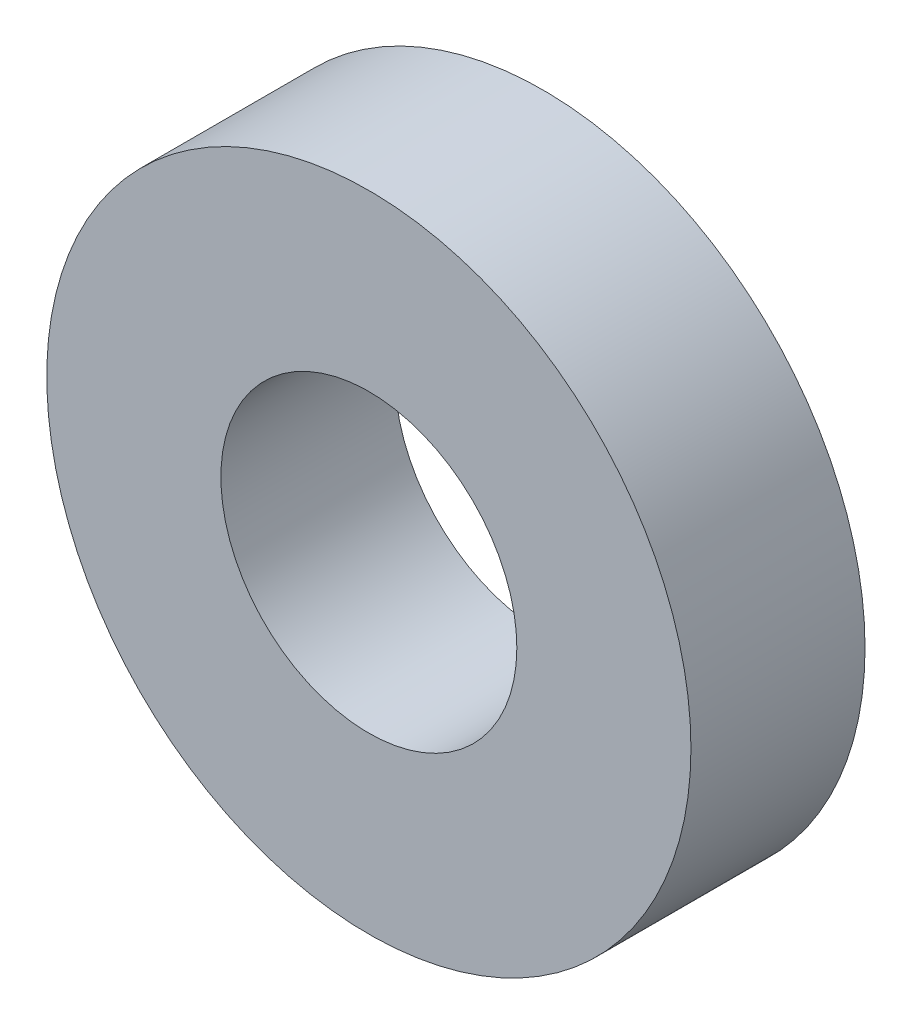
from build123d import *

# Parameters (mm, degrees)
SKETCH1_R           = 18.5
SKETCH1_R_2         = 8.5
BOSS_EXTRUDE1_DEPTH = 10


with BuildPart() as part:
    # Sketch1 → Boss-Extrude1 (new body)
    with BuildSketch(Plane.XY):
        Circle(SKETCH1_R)
        Circle(SKETCH1_R_2, mode=Mode.SUBTRACT)
    extrude(amount=BOSS_EXTRUDE1_DEPTH)


solid = part.part
